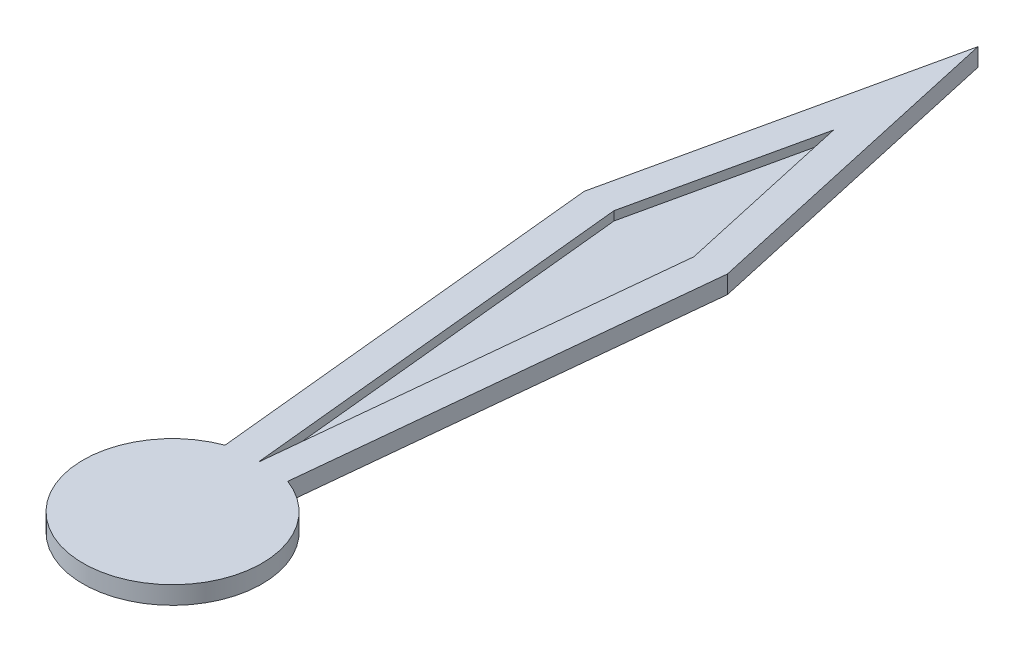
from build123d import *

# Parameters (mm, degrees)
EXTRUDE1_DEPTH = 0.2
EXTRUDE2_DEPTH = 0.1


with BuildPart() as part:
    # Sketch1 → Extrude1 (new body)
    with BuildSketch(Plane(origin=(0, 0, 0), x_dir=(1, 0, 0), z_dir=(0, 1, 0))):
        with BuildLine():
            Line((0, 9), (0.8, 5.4))
            Line((0.8, 5.4), (0.35, 0.9367497))
            ThreePointArc((0.35, 0.9367497), (0, -1), (-0.35, 0.9367497))
            Line((-0.35, 0.9367497), (-0.8, 5.4))
            Line((-0.8, 5.4), (0, 9))
        make_face()
    extrude(amount=EXTRUDE1_DEPTH)

    # Sketch2 → Extrude2 (cut)
    with BuildSketch(Plane(origin=(0, 0.2, 0), x_dir=(1, 0, 0), z_dir=(0, 1, 0))):
        Polygon((-0.001765488, 0.971859882), (0.001765488, 0.971859882), (0.446114686, 5.379063634), (0, 7.38657972), (-0.446114686, 5.379063634), align=None)
    extrude(amount=-EXTRUDE2_DEPTH, mode=Mode.SUBTRACT)


solid = part.part
